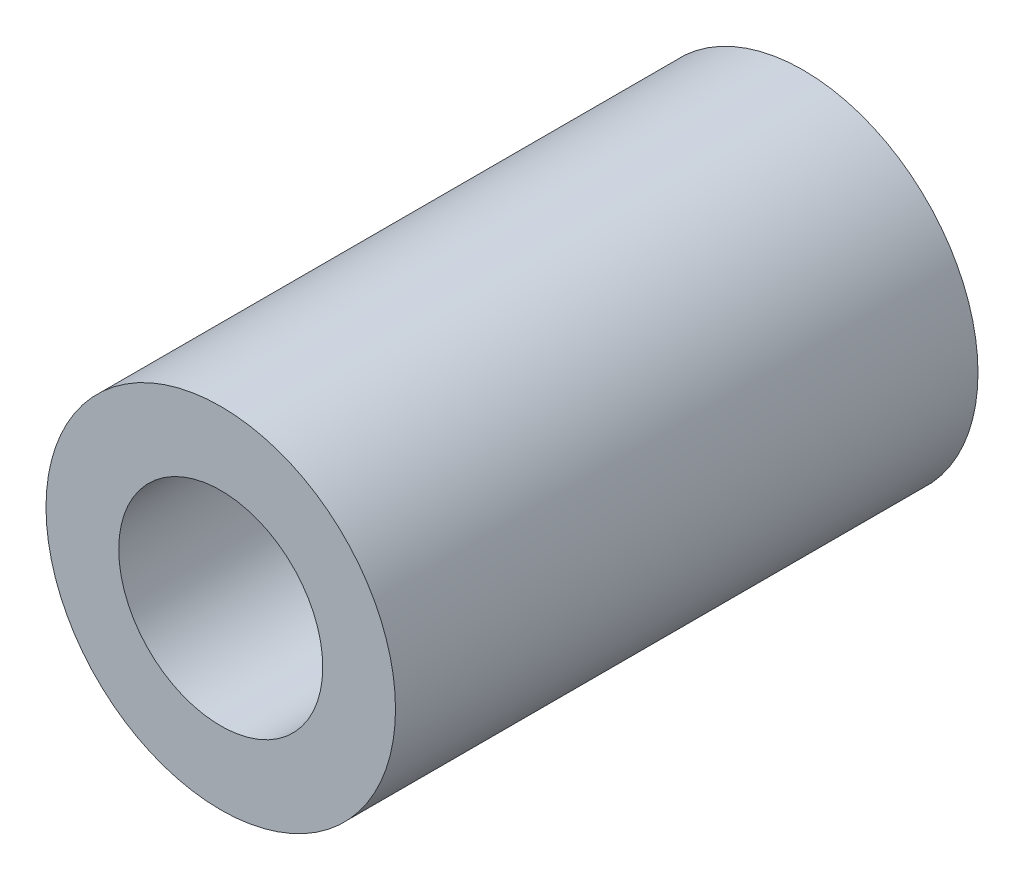
from build123d import *

# Parameters (mm, degrees)
SKETCH1_R           = 4.7625
SKETCH1_R_2         = 2.78
BOSS_EXTRUDE1_DEPTH = 15.875


with BuildPart() as part:
    # Sketch1 → Boss-Extrude1 (new body)
    with BuildSketch(Plane.XY):
        Circle(SKETCH1_R)
        Circle(SKETCH1_R_2, mode=Mode.SUBTRACT)
    extrude(amount=BOSS_EXTRUDE1_DEPTH)


solid = part.part
